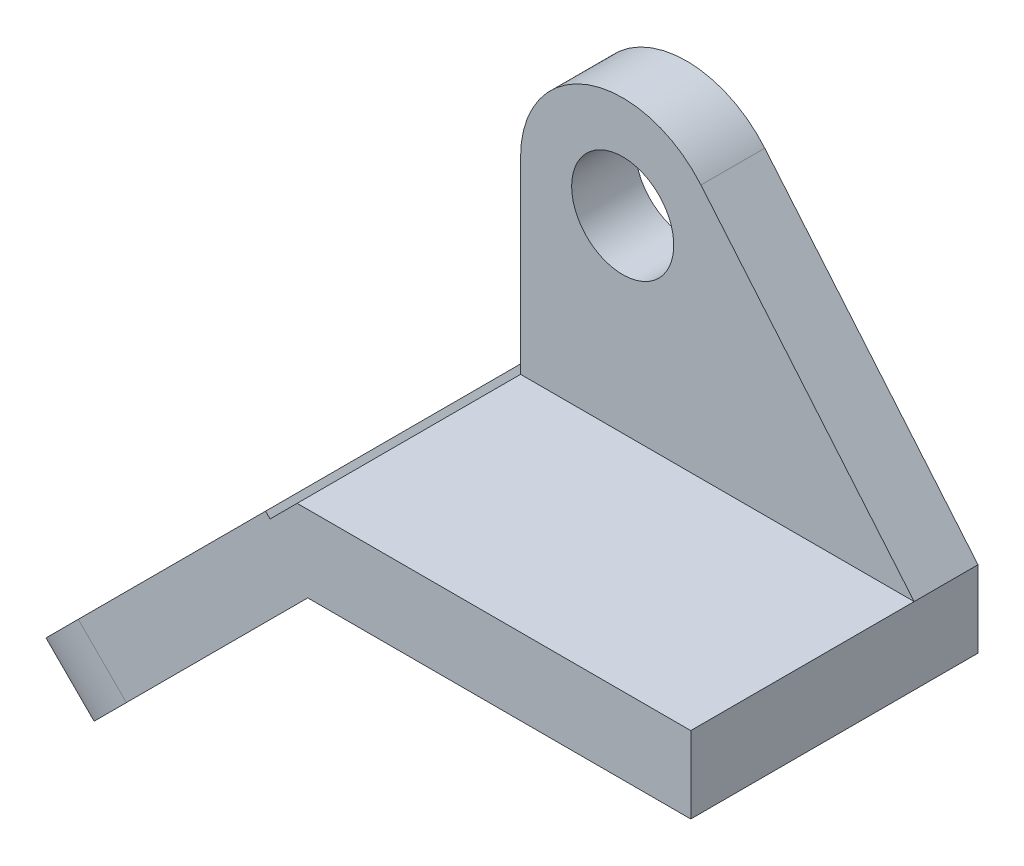
from build123d import *

# Parameters (mm, degrees)
EXTRUDE_1_DEPTH          = 45
SKETCH_3_R               = 8
EXTRUDE_2_DEPTH          = 10
FILLET_1_RADIUS          = 22.5
FILLET_1_LENGTH          = 10.659867141
CUT_EXTRUDE_1_DEPTH      = 97.311280041
CUT_EXTRUDE_1_DEPTH_BACK = 97.311280041


with BuildPart() as part:
    # 草图2 → 凸台-拉伸1 (new body)
    with BuildSketch(Plane.XY):
        Polygon((0, 0), (60, 0), (60, 12), (-1.661115121, 12), (-5.903755809, 7.757359313), (-6.61086259, 8.464466094), (-51.860645565, -36.785316881), (-44.322981223, -44.322981223), align=None)
    extrude(amount=EXTRUDE_1_DEPTH)

    # 草图3 → 凸台-拉伸2 (add)
    with BuildSketch(Plane(origin=(0, 0, 0), x_dir=(-1, 0, 0), z_dir=(0, 0, -1))):
        with BuildLine():
            Line((-60, 12), (-26.595595968, 51.809818513))
            ThreePointArc((-26.595595968, 51.809818513), (-8.866562585, 56.560298691), (1.661115121, 41.525216758))
            Line((1.661115121, 41.525216758), (1.661115121, 12))
            Line((1.661115121, 12), (-60, 12))
        make_face()
        with Locations((-14.338884879, 41.525216758)):
            Circle(SKETCH_3_R, mode=Mode.SUBTRACT)
    extrude(amount=-EXTRUDE_2_DEPTH)

    # 圆角1: full round fillet: the end face becomes a half cylinder, R = half its width
    fillet_1_face = Plane((-48.091813394, -40.554149052, 22.5), x_dir=(-0.707106781187, 0.707106781187, 0), z_dir=(-0.707106781187, -0.707106781187, 0))  # on the end face: x along it, z out of the body
    fillet_1_slab = fillet_1_face.offset(-FILLET_1_RADIUS / 2) * Box(FILLET_1_LENGTH, 2 * FILLET_1_RADIUS, FILLET_1_RADIUS, mode=Mode.PRIVATE)  # the body's end, R deep
    fillet_1_round = Plane((-32.181910817, -24.644246475, 22.5), x_dir=(-0.707106781187, -0.707106781187, 0), z_dir=(-0.707106781187, 0.707106781187, 0)) * Cylinder(FILLET_1_RADIUS, FILLET_1_LENGTH, mode=Mode.PRIVATE)  # its axis R under the face
    add(fillet_1_slab - fillet_1_round, mode=Mode.SUBTRACT)

    # 草图6 → 切除-拉伸1 (cut, two sides: drawn at the far end of the back side and taken through both)
    with BuildSketch(Plane(origin=(-7.537664342, 7.537664342, 0), x_dir=(0, 0, 1), z_dir=(-0.7071067811865487, 0.7071067811865465, 0)).offset(-CUT_EXTRUDE_1_DEPTH_BACK)):
        with BuildLine():
            Line((30.5, -20.182161171), (30.5, -40.182161171))
            ThreePointArc((30.5, -40.182161171), (22.5, -48.182161171), (14.5, -40.182161171))
            Line((14.5, -40.182161171), (14.5, -20.182161171))
            ThreePointArc((14.5, -20.182161171), (22.5, -12.182161171), (30.5, -20.182161171))
        make_face()
    extrude(amount=CUT_EXTRUDE_1_DEPTH + CUT_EXTRUDE_1_DEPTH_BACK, mode=Mode.SUBTRACT)


solid = part.part
